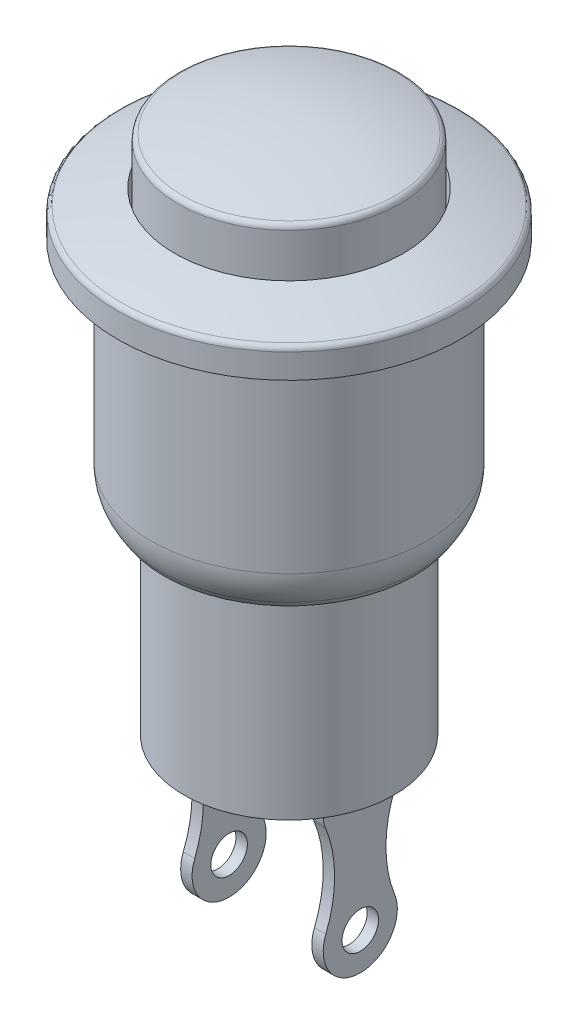
from build123d import *

# Parameters (mm, degrees)
CONG_1_R                = 0.2
CONG_2_R                = 0.2
CHANFREIN1_SIZE         = 0.7
CHANFREIN1_SIZE2        = 0.454585315
CONG_3_R                = 2
ESQUISSE2_W             = 0.4
ESQUISSE2_H             = 2.6
BOSS_EXTRU_1_DEPTH      = 6
ESQUISSE3_R             = 0.64
ENL_V_MAT_EXTRU_1_DEPTH = 6
CONG_4_R                = 1


with BuildPart() as part:
    # Esquisse1 → Révolution1 (revolve)
    with BuildSketch(Plane.XY, mode=Mode.PRIVATE) as r_volution1_sk:
        with BuildLine():
            Line((0, 18.8), (0, 0))
            Line((0, 0), (3.69, 0))
            Line((3.69, 0), (3.69, 7))
            Line((3.69, 7), (4.84, 7))
            Line((4.84, 7), (4.84, 15))
            Line((4.84, 15), (6.01, 15))
            Line((6.01, 15), (6.01, 16))
            ThreePointArc((6.01, 16), (5.013982948, 16.330092875), (4, 16.6))
            Line((4, 16.6), (4, 15.013190638))
            Line((4, 15.013190638), (3.89, 15.013190638))
            Line((3.89, 15.013190638), (3.89, 18.2))
            ThreePointArc((3.89, 18.2), (1.968000254, 18.649118314), (0, 18.8))
        make_face()
    revolve(r_volution1_sk.sketch.rotate(Axis((0, 0, 0), (0, 1, 0)), 90), axis=Axis((0, 0, 0), (0, 1, 0)))

    # Congé1
    cong_1_edges = [part.edges().sort_by_distance(p)[0] for p in [
        (0, 18.2, 3.89),
    ]]
    fillet(cong_1_edges, radius=CONG_1_R)

    # Congé2
    cong_2_edges = [part.edges().sort_by_distance(p)[0] for p in [
        (0, 16, 6.01),
    ]]
    fillet(cong_2_edges, radius=CONG_2_R)

    # Chanfrein1
    chanfrein1_edges = [part.edges().sort_by_distance(p)[0] for p in [
        (0, 7, 4.84),
    ]]
    chanfrein1_side = [part.faces().sort_by_distance(p)[0] for p in [
        (0, 11, 4.84),
    ]]
    chamfer(chanfrein1_edges, length=CHANFREIN1_SIZE, length2=CHANFREIN1_SIZE2, reference=chanfrein1_side[0])

    # Congé3
    cong_3_edges = [part.edges().sort_by_distance(p)[0] for p in [
        (0, 7.7, 4.84),
    ]]
    fillet(cong_3_edges, radius=CONG_3_R)

    # Esquisse2 → Boss.-Extru.1 (add)
    with BuildSketch(Plane.XZ):
        with Locations((2.3, 0)):
            Rectangle(ESQUISSE2_W, ESQUISSE2_H)
        with Locations((-2.3, 0)):
            Rectangle(ESQUISSE2_W, ESQUISSE2_H)
    extrude(amount=BOSS_EXTRU_1_DEPTH)

    # Esquisse3 → Enlèv. mat.-Extru.1 (cut)
    with BuildSketch(Plane.ZY.offset(2.5)):
        with Locations((0, -4.7)):
            Circle(ESQUISSE3_R)
        with BuildLine():
            Line((-1.3, -0.8), (-4.192462756, -0.8))
            Line((-4.192462756, -0.8), (-4.192462756, -7.475627282))
            Line((-4.192462756, -7.475627282), (5.572809524, -7.57510374))
            Line((5.572809524, -7.57510374), (5.225347222, -0.8))
            Line((5.225347222, -0.8), (1.3, -0.8))
            ThreePointArc((1.3, -0.8), (0.901580438, -2.499750503), (1.207561262, -4.218548238))
            ThreePointArc((1.207561262, -4.218548238), (0, -6), (-1.207561262, -4.218548238))
            ThreePointArc((-1.207561262, -4.218548238), (-0.901580438, -2.499750503), (-1.3, -0.8))
        make_face()
    extrude(amount=-ENL_V_MAT_EXTRU_1_DEPTH, mode=Mode.SUBTRACT)

    # Congé4
    cong_4_edges = [part.edges().sort_by_distance(p)[0] for p in [
        (-2.3, -0.8, 1.3),
        (-2.3, -0.8, -1.3),
        (2.3, -0.8, -1.3),
        (2.3, -0.8, 1.3),
    ]]
    fillet(cong_4_edges, radius=CONG_4_R)


solid = part.part
